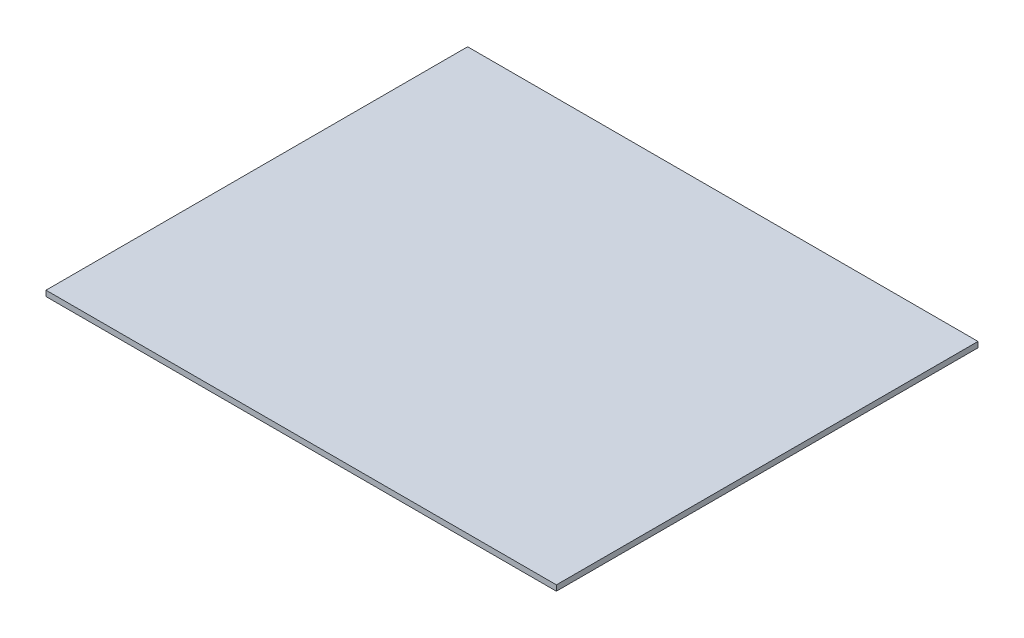
from build123d import *

# Parameters (mm, degrees)
EXTRUDE_START    = -280
SKETCH_1_W       = 460
SKETCH_1_H       = 5
EXTRUDE_Y0_DEPTH = 380


with BuildPart() as part:
    # 草图1 → 地面基准_顶面Y0 (new body)
    with BuildSketch(Plane.XY.offset(EXTRUDE_START)):
        with Locations((0, -2.5)):
            Rectangle(SKETCH_1_W, SKETCH_1_H)
    extrude(amount=EXTRUDE_Y0_DEPTH)


solid = part.part
